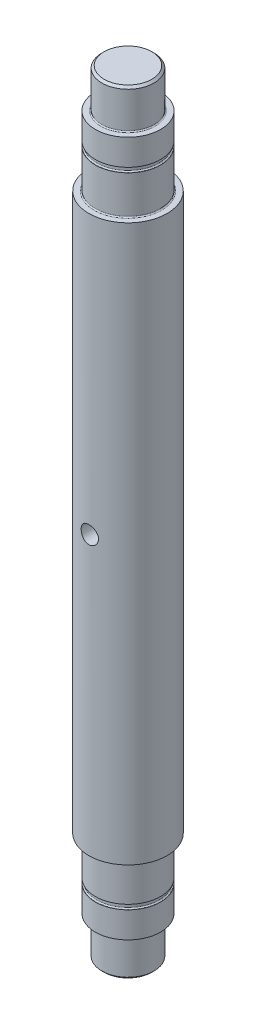
from build123d import *

# Parameters (mm, degrees)
CUT_EXTRUDE2_DEPTH      = 90.905505949
CUT_EXTRUDE2_DEPTH_BACK = 90.905505949
SKETCH3_R               = 2
FILLET1_R               = 0.25
CHAMFER1_SIZE           = 0.5


with BuildPart() as part:
    # Sketch1 → Revolve1 (revolve)
    with BuildSketch(Plane.XY, mode=Mode.PRIVATE) as revolve1_sk:
        Polygon((0, 89), (6, 89), (6, 80), (7.5, 80), (7.5, 74), (7.15, 74), (7.15, 72.9), (7.5, 72.9), (7.5, 64), (9, 64), (9, -64), (7.5, -64), (7.5, -72.9), (7.15, -72.9), (7.15, -74), (7.5, -74), (7.5, -80), (6, -80), (6, -89), (0, -89), align=None)
    revolve(revolve1_sk.sketch.rotate(Axis((0, 63.257285949, 0), (0, -1, 0)), 90), axis=Axis((0, 63.257285949, 0), (0, -1, 0)))

    # Sketch3 → Cut-Extrude2 (cut, two sides: drawn at the far end of the back side and taken through both)
    with BuildSketch(Plane.XY.offset(-CUT_EXTRUDE2_DEPTH_BACK)):
        with Locations(Location((0, 0, 0), (0, 0, 90))):
            Circle(SKETCH3_R)
    extrude(amount=CUT_EXTRUDE2_DEPTH + CUT_EXTRUDE2_DEPTH_BACK, mode=Mode.SUBTRACT)

    # Fillet1
    fillet1_edges = [part.edges().sort_by_distance(p)[0] for p in [
        (0, -80, -6),
        (0, -74, -7.15),
        (0, -72.9, -7.15),
        (0, -64, -7.5),
        (0, 64, -7.5),
        (0, 72.9, -7.15),
        (0, 74, -7.15),
        (0, 80, -6),
    ]]
    fillet(fillet1_edges, radius=FILLET1_R)

    # Chamfer1
    chamfer1_edges = [part.edges().sort_by_distance(p)[0] for p in [
        (0, -89, -6),
        (0, 89, -6),
    ]]
    chamfer(chamfer1_edges, length=CHAMFER1_SIZE)


solid = part.part
